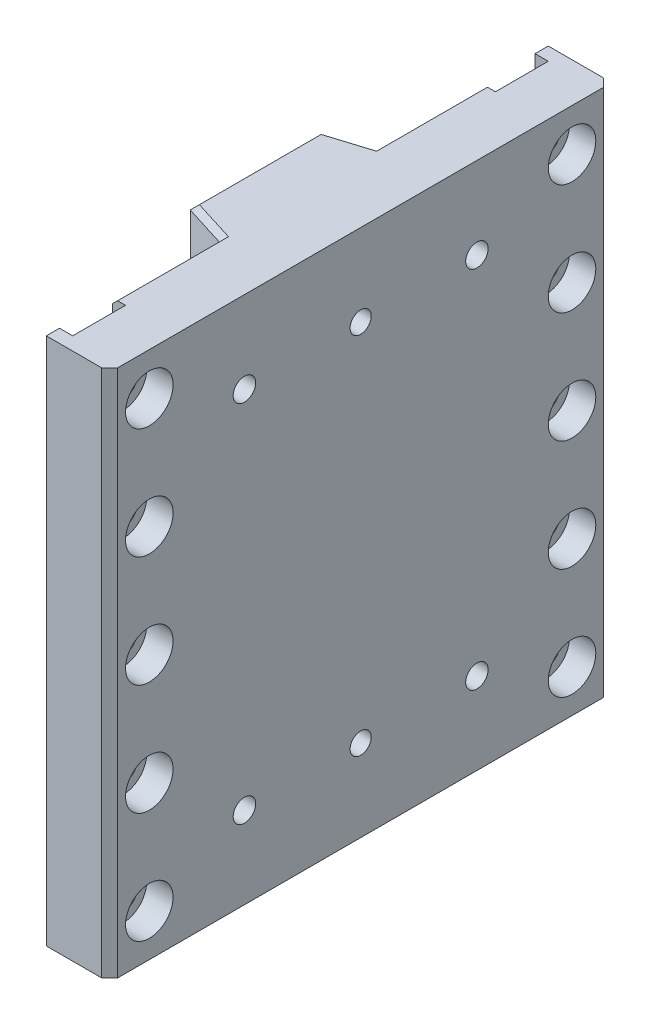
from build123d import *

# Parameters (mm, degrees)
ESTRUSIONE1_DEPTH                                    = 200
M10_LAMATURA_PER_VITE_A_COPERTURA_CILIND_D           = 11
M10_LAMATURA_PER_VITE_A_COPERTURA_CILIND_CBORE_D     = 18
M10_LAMATURA_PER_VITE_A_COPERTURA_CILIND_CBORE_DEPTH = 10
RIPETIZIONE_A_L1_COUNT                               = 5
RIPETIZIONE_A_L1_PITCH                               = 42
RIPETIZIONE_A_L1_COUNT_DIR2                          = 2
RIPETIZIONE_A_L1_PITCH_DIR2                          = 160
SMUSSO1_SIZE                                         = 3
ESTRUSIONE2_DEPTH                                    = 223.712819568
M10_TAPPED_HOLE1_D                                   = 8.5
M10_TAPPED_HOLE1_DEPTH                               = 17.5
M10_TAPPED_HOLE1_TIP                                 = 2.553657631
SCHIZZO10_R                                          = 4
ESTRUSIONE3_DEPTH                                    = 12
ESTRUSIONE5_DEPTH                                    = 200
SMUSSO2_SIZE                                         = 2


with BuildPart() as part:
    # Schizzo1 → Estrusione1 (new body)
    with BuildSketch(Plane(origin=(0, 0, 0), x_dir=(1, 0, 0), z_dir=(0, 1, 0))):
        Polygon((0, -95), (0, 95), (-24, 95), (-24, 90), (-19, 90), (-19, 70), (-24, 70), (-24, -70), (-19, -70), (-19, -90), (-24, -90), (-24, -95), align=None)
    extrude(amount=ESTRUSIONE1_DEPTH)

    # M10 Lamatura per vite a copertura cilind (through all)
    with Locations(Plane(origin=(0, 0, 0), x_dir=(0, 0, -1), z_dir=(1, 0, 0))):
        with Locations((-80, 184)):
            m10_lamatura_per_vite_a_copertura_cilind = CounterBoreHole(M10_LAMATURA_PER_VITE_A_COPERTURA_CILIND_D / 2, M10_LAMATURA_PER_VITE_A_COPERTURA_CILIND_CBORE_D / 2, M10_LAMATURA_PER_VITE_A_COPERTURA_CILIND_CBORE_DEPTH)

    # Ripetizione a L1: M10 Lamatura per vite a copertura cilind 5 × 2
    with Locations(*[(0, -i * RIPETIZIONE_A_L1_PITCH, -j * RIPETIZIONE_A_L1_PITCH_DIR2) for i in range(RIPETIZIONE_A_L1_COUNT) for j in range(RIPETIZIONE_A_L1_COUNT_DIR2) if (i, j) != (0, 0)]):
        add(m10_lamatura_per_vite_a_copertura_cilind, mode=Mode.SUBTRACT)

    # Smusso1
    smusso1_edges = [part.edges().sort_by_distance(p)[0] for p in [
        (0, 100, -95),
        (0, 100, 95),
    ]]
    chamfer(smusso1_edges, length=SMUSSO1_SIZE)

    # Schizzo4 → Estrusione2 (cut, through all)
    with BuildSketch(Plane(origin=(0, 200, 0), x_dir=(1, 0, 0), z_dir=(0, 1, 0))):
        Polygon((-22, -29.5), (-22, 29.5), (-31.824658815, 29.5), (-31.824658815, 0), (-31.824658815, -29.5), align=None)
    extrude(amount=-ESTRUSIONE2_DEPTH, mode=Mode.SUBTRACT)

    # M10 Tapped Hole1
    with Locations(Plane(origin=(0, 0, 0), x_dir=(0, 0, -1), z_dir=(1, 0, 0))):
        with Locations((-44, 169), (44, 169), (44, 31), (-44, 31)):
            Hole(M10_TAPPED_HOLE1_D / 2, depth=M10_TAPPED_HOLE1_DEPTH)
            with Locations((0, 0, -(M10_TAPPED_HOLE1_DEPTH + M10_TAPPED_HOLE1_TIP / 2))):  # 118° drill point
                Cone(0, M10_TAPPED_HOLE1_D / 2, M10_TAPPED_HOLE1_TIP, mode=Mode.SUBTRACT)

    # Schizzo10 → Estrusione3 (cut)
    with BuildSketch(Plane(origin=(0, 0, 0), x_dir=(0, 0, -1), z_dir=(1, 0, 0))):
        with Locations((0, 169)):
            Circle(SCHIZZO10_R)
        with Locations(Location((0, 31, 0), (0, 0, 180))):
            Circle(SCHIZZO10_R)
    extrude(amount=-ESTRUSIONE3_DEPTH, mode=Mode.SUBTRACT)

    # Schizzo12 → Estrusione5 (add)
    with BuildSketch(Plane(origin=(0, 200, 0), x_dir=(1, 0, 0), z_dir=(0, 1, 0))):
        Polygon((-24, 29.5), (-40, 24.5), (-40, -24.5), (-24, -29.5), (-22, -29.5), (-22, 29.5), align=None)
    extrude(amount=-ESTRUSIONE5_DEPTH)

    # Smusso2
    smusso2_edges = [part.edges().sort_by_distance(p)[0] for p in [
        (-24, 200, 49.75),
        (-32, 200, -27),
        (-40, 200, 0),
        (-32, 200, 27),
        (-24, 200, -49.75),
    ]]
    chamfer(smusso2_edges, length=SMUSSO2_SIZE)


solid = part.part
